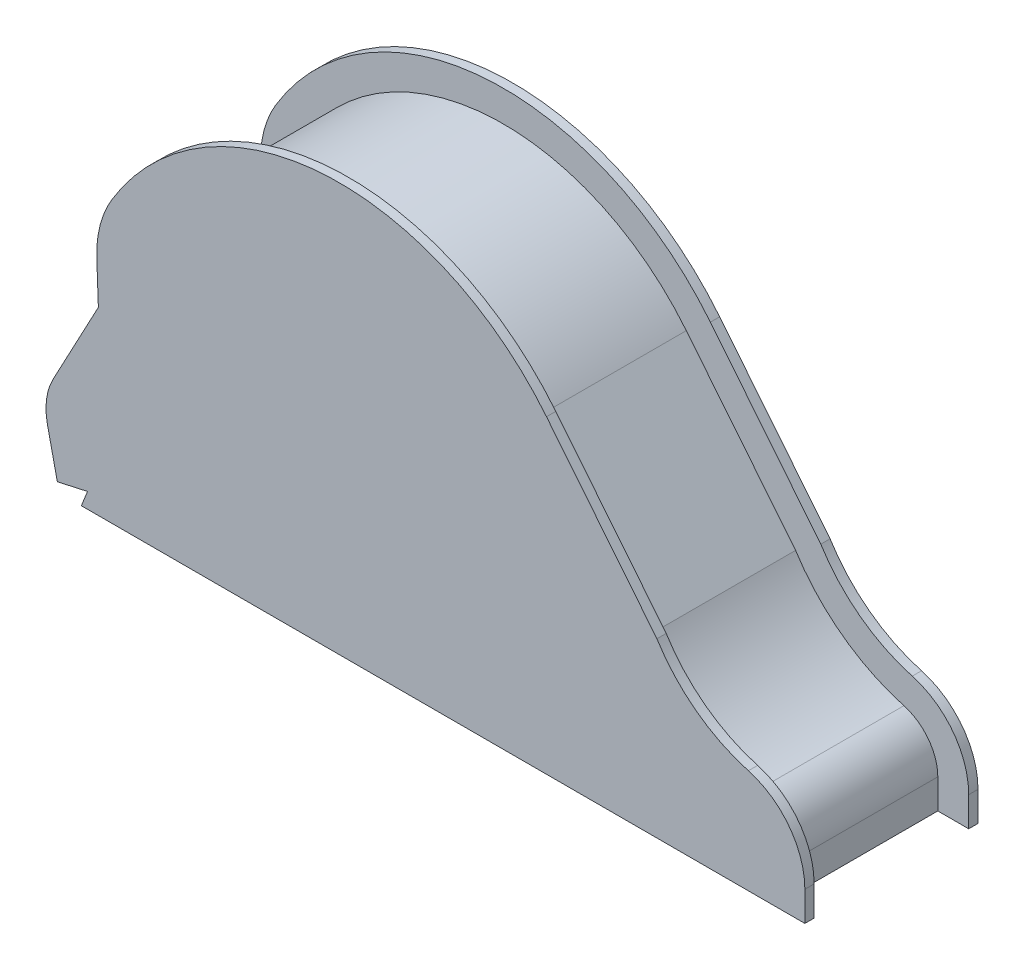
from build123d import *

# Parameters (mm, degrees)
AUFSATZ_LINEAR_AUSTRAGEN1_DEPTH = 28
AUFSATZ_LINEAR_AUSTRAGEN2_DEPTH = 1.5


with BuildPart() as part:
    # Skizze2 → Aufsatz-Linear austragen1 (new body)
    with BuildSketch(Plane.XY):
        with BuildLine():
            Line((0, 0), (112, 0))
            Line((112, 0), (112, 4.782759721))
            ThreePointArc((112, 4.782759721), (110.475234931, 9.315591895), (106.520915328, 12.005356293))
            ThreePointArc((106.520915328, 12.005356293), (96.560287053, 16.884466202), (89, 25))
            Line((89, 25), (71.329947288, 46.937212002))
            ThreePointArc((71.329947288, 46.937212002), (39.188190047, 61.014465273), (9.219098516, 42.763022288))
            ThreePointArc((9.219098516, 42.763022288), (7.87025923, 39.559587955), (7.496101502, 36.103959945))
            Line((7.496101502, 36.103959945), (7.8, 28))
            Line((7.8, 28), (-0.129590409, 13.132017983))
            ThreePointArc((-0.129590409, 13.132017983), (-0.671897822, 11.455219867), (-0.598761004, 9.694424518))
            Line((-0.598761004, 9.694424518), (1, 2.5))
            Line((1, 2.5), (0, 0))
        make_face()
    extrude(amount=-AUFSATZ_LINEAR_AUSTRAGEN1_DEPTH)

    # Skizze3 → Aufsatz-Linear austragen2 (add)
    with BuildSketch(Plane.XY):
        with BuildLine():
            Line((93.075548833, 27.910970342), (75.223854733, 50.073688497))
            ThreePointArc((75.223854733, 50.073688497), (38.852918908, 66.003211935), (4.94052586, 45.350263295))
            ThreePointArc((4.94052586, 45.350263295), (3.029670204, 40.812064656), (2.499613424, 35.916591642))
            Line((2.499613424, 35.916591642), (2.752920862, 29.161726616))
            Line((2.752920862, 29.161726616), (-4.541355115, 15.48495916))
            ThreePointArc((-4.541355115, 15.48495916), (-5.625969942, 12.131362926), (-5.479696305, 8.609772229))
            Line((-5.479696305, 8.609772229), (-3.880935301, 1.415347711))
            Line((-3.880935301, 1.415347711), (1, 2.5))
            Line((1, 2.5), (-0.598761004, 9.694424518))
            ThreePointArc((-0.598761004, 9.694424518), (-0.671897822, 11.455219867), (-0.129590409, 13.132017983))
            Line((-0.129590409, 13.132017983), (7.8, 28))
            Line((7.8, 28), (7.496101502, 36.103959945))
            ThreePointArc((7.496101502, 36.103959945), (7.87025923, 39.559587955), (9.219098516, 42.763022288))
            ThreePointArc((9.219098516, 42.763022288), (39.188190047, 61.014465273), (71.329947288, 46.937212002))
            Line((71.329947288, 46.937212002), (89, 25))
            ThreePointArc((89, 25), (96.560287053, 16.884466202), (106.520915328, 12.005356293))
            ThreePointArc((106.520915328, 12.005356293), (110.475234931, 9.315591895), (112, 4.782759721))
            Line((112, 4.782759721), (112, 0))
            Line((112, 0), (117, 0))
            Line((117, 0), (117, 4.782759721))
            ThreePointArc((117, 4.782759721), (114.458724885, 12.337480011), (107.868192213, 16.820420674))
            ThreePointArc((107.868192213, 16.820420674), (99.43268373, 20.97962177), (93.075548833, 27.910970342))
        make_face()
    aufsatz_linear_austragen2 = extrude(amount=-AUFSATZ_LINEAR_AUSTRAGEN2_DEPTH)

    # Spiegeln1: Aufsatz-Linear austragen2 across plane
    add(aufsatz_linear_austragen2.mirror(Plane.XY.offset(-14)))


solid = part.part
